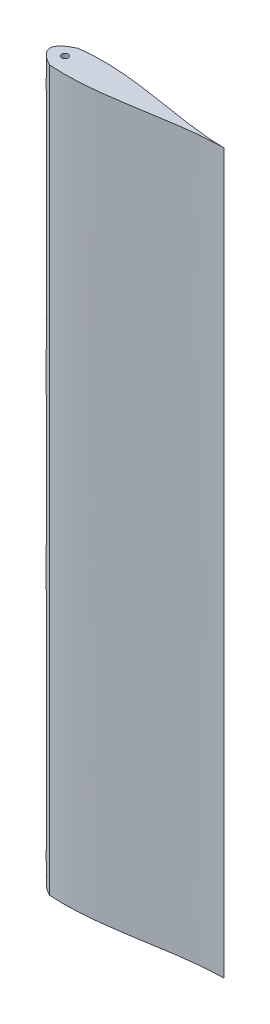
from build123d import *

# Parameters (mm, degrees)
BOSS_EXTRUDE1_DEPTH = 100
SKETCH3_R           = 0.454289721
CUT_EXTRUDE1_DEPTH  = 100


with BuildPart() as part:
    # Sketch2 → Boss-Extrude1 (new body)
    with BuildSketch(Plane(origin=(0, 0, 0), x_dir=(1, 0, 0), z_dir=(0, 1, 0))):
        with BuildLine():
            add(Edge.make_bspline(
                [(-10.500794878, 1.852228916), (-3.025175256, 2.789493096), (4.202001946, 0.108815967), (11.590391562, 0)],
                knots=[0, 0, 0, 0, 0.960648021, 0.960648021, 0.960648021, 0.960648021], degree=3))
            add(Edge.make_bspline(
                [(-10.500794878, 1.852228916), (-14.506246481, 0.000403345), (-10.500794878, -2.147771084)],
                knots=[0, 0, 0, 1, 1, 1], degree=2))
            add(Edge.make_bspline(
                [(-10.500794878, -2.147771084), (-3.042051583, -2.687380656), (4.196203208, -0.104570374), (11.590391562, 0)],
                knots=[0, 0, 0, 0, 0.960676416, 0.960676416, 0.960676416, 0.960676416], degree=3))
        make_face()
    extrude(amount=BOSS_EXTRUDE1_DEPTH)

    # Sketch3 → Cut-Extrude1 (cut)
    with BuildSketch(Plane(origin=(0, 100, 0), x_dir=(1, 0, 0), z_dir=(0, 1, 0))):
        with Locations(Location((-10.50352068, 0, 0), (0, 0, 270))):
            Circle(SKETCH3_R)
    extrude(amount=-CUT_EXTRUDE1_DEPTH, mode=Mode.SUBTRACT)


solid = part.part
